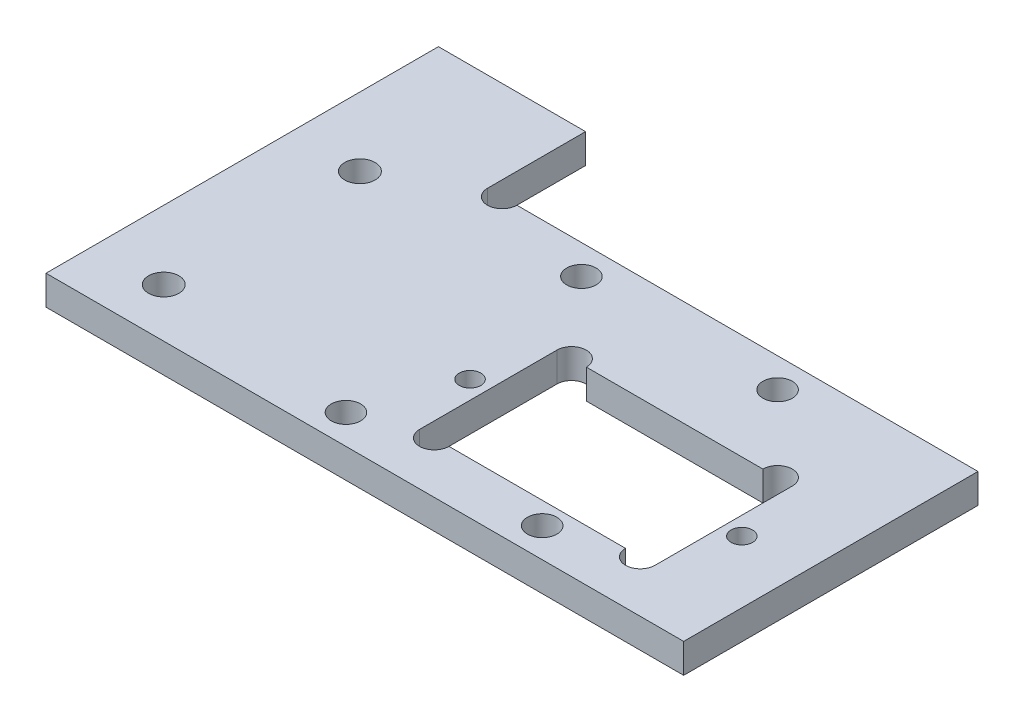
from build123d import *

# Parameters (mm, degrees)
SKETCH_1_W          = 65
SKETCH_1_H          = 40
EXTRUDE_1_DEPTH     = 3
SKETCH_2_R          = 1.55
CUT_EXTRUDE_1_DEPTH = 10
SKETCH_3_W          = 50
SKETCH_3_H          = 10
CUT_EXTRUDE_2_DEPTH = 10
SKETCH_4_W          = 24
SKETCH_4_H          = 14
CUT_EXTRUDE_3_DEPTH = 10
SKETCH_5_R          = 1.1
CUT_EXTRUDE_4_DEPTH = 10
SKETCH_6_R          = 1.5
CUT_EXTRUDE_5_DEPTH = 25
HOLE_WIZARD_1_D     = 3


with BuildPart() as part:
    # 草图1 → 凸台-拉伸1 (new body)
    with BuildSketch(Plane(origin=(0, 0, 0), x_dir=(1, 0, 0), z_dir=(0, 1, 0))):
        Rectangle(SKETCH_1_W, SKETCH_1_H)
    extrude(amount=EXTRUDE_1_DEPTH)

    # 草图2 → 切除-拉伸1 (cut)
    with BuildSketch(Plane(origin=(0, 0, 0), x_dir=(-1, 0, 0), z_dir=(0, -1, 0))):
        with Locations(Location((25.5, -15, 0), (0, 0, 90))):
            Circle(SKETCH_2_R)
        with Locations(Location((25.5, 5, 0), (0, 0, 90))):
            Circle(SKETCH_2_R)
    extrude(amount=-CUT_EXTRUDE_1_DEPTH, mode=Mode.SUBTRACT)

    # 草图3 → 切除-拉伸2 (cut)
    with BuildSketch(Plane(origin=(0, 0, 0), x_dir=(-1, 0, 0), z_dir=(0, -1, 0))):
        with Locations((-7.5, 15)):
            Rectangle(SKETCH_3_W, SKETCH_3_H)
    extrude(amount=-CUT_EXTRUDE_2_DEPTH, mode=Mode.SUBTRACT)

    # 草图4 → 切除-拉伸3 (cut)
    with BuildSketch(Plane(origin=(0, 0, 0), x_dir=(-1, 0, 0), z_dir=(0, -1, 0))):
        with Locations((-12.32495, -7.75)):
            Rectangle(SKETCH_4_W, SKETCH_4_H)
    extrude(amount=-CUT_EXTRUDE_3_DEPTH, mode=Mode.SUBTRACT)

    # 草图5 → 切除-拉伸4 (cut)
    with BuildSketch(Plane(origin=(0, 3, 0), x_dir=(1, 0, 0), z_dir=(0, 1, 0))):
        with Locations(Location((26.17495, -7.75, 0), (0, 0, 270))):
            Circle(SKETCH_5_R)
        with Locations(Location((-1.52505, -7.75, 0), (0, 0, 270))):
            Circle(SKETCH_5_R)
    extrude(amount=-CUT_EXTRUDE_4_DEPTH, mode=Mode.SUBTRACT)

    # 草图6 → 切除-拉伸5 (cut)
    with BuildSketch(Plane(origin=(0, 0, 0), x_dir=(-1, 0, 0), z_dir=(0, -1, 0))):
        with Locations(Location((-15.074975, -17, 0), (0, 0, 90))):
            Circle(SKETCH_6_R)
        with Locations(Location((4.925025, -17, 0), (0, 0, 90))):
            Circle(SKETCH_6_R)
        with Locations(Location((-15.074975, 7, 0), (0, 0, 90))):
            Circle(SKETCH_6_R)
        with Locations(Location((4.925025, 7, 0), (0, 0, 90))):
            Circle(SKETCH_6_R)
    extrude(amount=-CUT_EXTRUDE_5_DEPTH, mode=Mode.SUBTRACT)

    # 孔1 (through all)
    with Locations(Plane(origin=(0, 3, 0), x_dir=(1, 0, 0), z_dir=(0, 1, 0))):
        with Locations((-16, 10), (1.82495, -0.75), (22.82495, -0.75), (22.82495, -14.75), (1.82495, -14.75)):
            Hole(HOLE_WIZARD_1_D / 2)


solid = part.part
